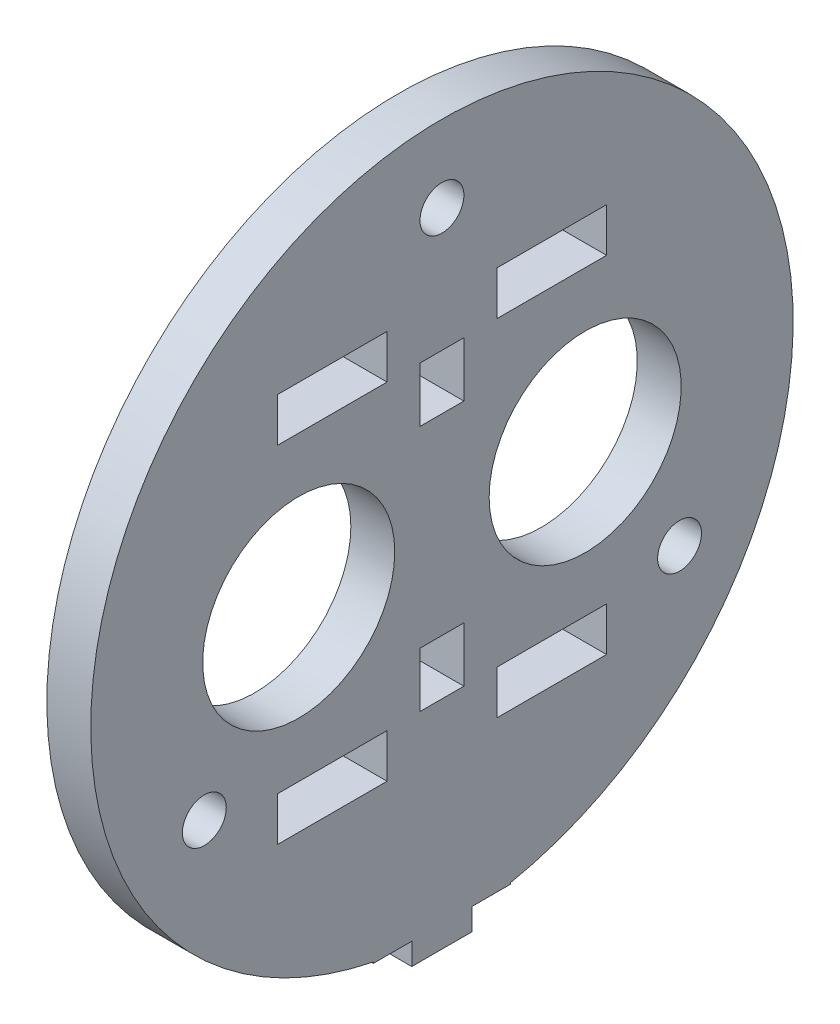
from build123d import *

# Parameters (mm, degrees)
SKETCH1_R           = 4
SKETCH1_R_2         = 17.5
BOSS_EXTRUDE1_DEPTH = 8
CUT_EXTRUDE1_REACH  = 95
SKETCH2_W           = 20
SKETCH2_H           = 8
SKETCH2_W_2         = 8
SKETCH2_H_2         = 10
SKETCH2_W_3         = 7
SKETCH2_H_3         = 4


with BuildPart() as part:
    # Sketch1 → Boss-Extrude1 (new body)
    with BuildSketch(Plane(origin=(0, 0, 0), x_dir=(0, 0, -1), z_dir=(1, 0, 0))):
        with BuildLine():
            Line((-12.5, -62.767427859), (-12.5, -67))
            Line((-12.5, -67), (12.5, -67))
            Line((12.5, -67), (12.5, -62.767427859))
            ThreePointArc((12.5, -62.767427859), (0, 64), (-12.5, -62.767427859))
        make_face()
        with Locations((0, 50)):
            Circle(SKETCH1_R, mode=Mode.SUBTRACT)
        with Locations((43.301270189, -25)):
            Circle(SKETCH1_R, mode=Mode.SUBTRACT)
        with Locations((-43.301270189, -25)):
            Circle(SKETCH1_R, mode=Mode.SUBTRACT)
        with Locations((-26.1, 0)):
            Circle(SKETCH1_R_2, mode=Mode.SUBTRACT)
        with Locations(Location((26.1, 0, 0), (0, 0, 180))):
            Circle(SKETCH1_R_2, mode=Mode.SUBTRACT)
    extrude(amount=BOSS_EXTRUDE1_DEPTH)

    # Sketch2 → Cut-Extrude1 (cut, up to next)
    with BuildSketch(Plane.ZY, mode=Mode.PRIVATE) as cut_extrude1_sk1:
        with Locations((20, -31.5)):
            Rectangle(SKETCH2_W, SKETCH2_H)
    cut_extrude1_tool1 = extrude(cut_extrude1_sk1.sketch, amount=-CUT_EXTRUDE1_REACH, mode=Mode.PRIVATE) & part.part
    # Sketch2 → Cut-Extrude1 (cut, up to next)
    with BuildSketch(Plane.ZY, mode=Mode.PRIVATE) as cut_extrude1_sk2:
        with Locations((-20, -31.5)):
            Rectangle(SKETCH2_W, SKETCH2_H)
    cut_extrude1_tool2 = extrude(cut_extrude1_sk2.sketch, amount=-CUT_EXTRUDE1_REACH, mode=Mode.PRIVATE) & part.part
    # Sketch2 → Cut-Extrude1 (cut, up to next)
    with BuildSketch(Plane.ZY, mode=Mode.PRIVATE) as cut_extrude1_sk3:
        with Locations((20, 31.5)):
            Rectangle(SKETCH2_W, SKETCH2_H)
    cut_extrude1_tool3 = extrude(cut_extrude1_sk3.sketch, amount=-CUT_EXTRUDE1_REACH, mode=Mode.PRIVATE) & part.part
    # Sketch2 → Cut-Extrude1 (cut, up to next)
    with BuildSketch(Plane.ZY, mode=Mode.PRIVATE) as cut_extrude1_sk4:
        with Locations((-20, 31.5)):
            Rectangle(SKETCH2_W, SKETCH2_H)
    cut_extrude1_tool4 = extrude(cut_extrude1_sk4.sketch, amount=-CUT_EXTRUDE1_REACH, mode=Mode.PRIVATE) & part.part
    # Sketch2 → Cut-Extrude1 (cut, up to next)
    with BuildSketch(Plane.ZY, mode=Mode.PRIVATE) as cut_extrude1_sk5:
        with Locations((0, 22.5)):
            Rectangle(SKETCH2_W_2, SKETCH2_H_2)
    cut_extrude1_tool5 = extrude(cut_extrude1_sk5.sketch, amount=-CUT_EXTRUDE1_REACH, mode=Mode.PRIVATE) & part.part
    # Sketch2 → Cut-Extrude1 (cut, up to next)
    with BuildSketch(Plane.ZY, mode=Mode.PRIVATE) as cut_extrude1_sk6:
        with Locations((0, -22.5)):
            Rectangle(SKETCH2_W_2, SKETCH2_H_2)
    cut_extrude1_tool6 = extrude(cut_extrude1_sk6.sketch, amount=-CUT_EXTRUDE1_REACH, mode=Mode.PRIVATE) & part.part
    # Sketch2 → Cut-Extrude1 (cut, up to next)
    with BuildSketch(Plane.ZY, mode=Mode.PRIVATE) as cut_extrude1_sk7:
        with Locations((9, -65)):
            Rectangle(SKETCH2_W_3, SKETCH2_H_3)
    cut_extrude1_tool7 = extrude(cut_extrude1_sk7.sketch, amount=-CUT_EXTRUDE1_REACH, mode=Mode.PRIVATE) & part.part
    # Sketch2 → Cut-Extrude1 (cut, up to next)
    with BuildSketch(Plane.ZY, mode=Mode.PRIVATE) as cut_extrude1_sk8:
        with Locations((-9, -65)):
            Rectangle(SKETCH2_W_3, SKETCH2_H_3)
    cut_extrude1_tool8 = extrude(cut_extrude1_sk8.sketch, amount=-CUT_EXTRUDE1_REACH, mode=Mode.PRIVATE) & part.part
    add(cut_extrude1_tool1.solids().sort_by_distance((0, -31.5, 20))[0], mode=Mode.SUBTRACT)
    add(cut_extrude1_tool2.solids().sort_by_distance((0, -31.5, -20))[0], mode=Mode.SUBTRACT)
    add(cut_extrude1_tool3.solids().sort_by_distance((0, 31.5, 20))[0], mode=Mode.SUBTRACT)
    add(cut_extrude1_tool4.solids().sort_by_distance((0, 31.5, -20))[0], mode=Mode.SUBTRACT)
    add(cut_extrude1_tool5.solids().sort_by_distance((0, 22.5, 0))[0], mode=Mode.SUBTRACT)
    add(cut_extrude1_tool6.solids().sort_by_distance((0, -22.5, 0))[0], mode=Mode.SUBTRACT)
    add(cut_extrude1_tool7.solids().sort_by_distance((0, -65, 9))[0], mode=Mode.SUBTRACT)
    add(cut_extrude1_tool8.solids().sort_by_distance((0, -65, -9))[0], mode=Mode.SUBTRACT)


solid = part.part
